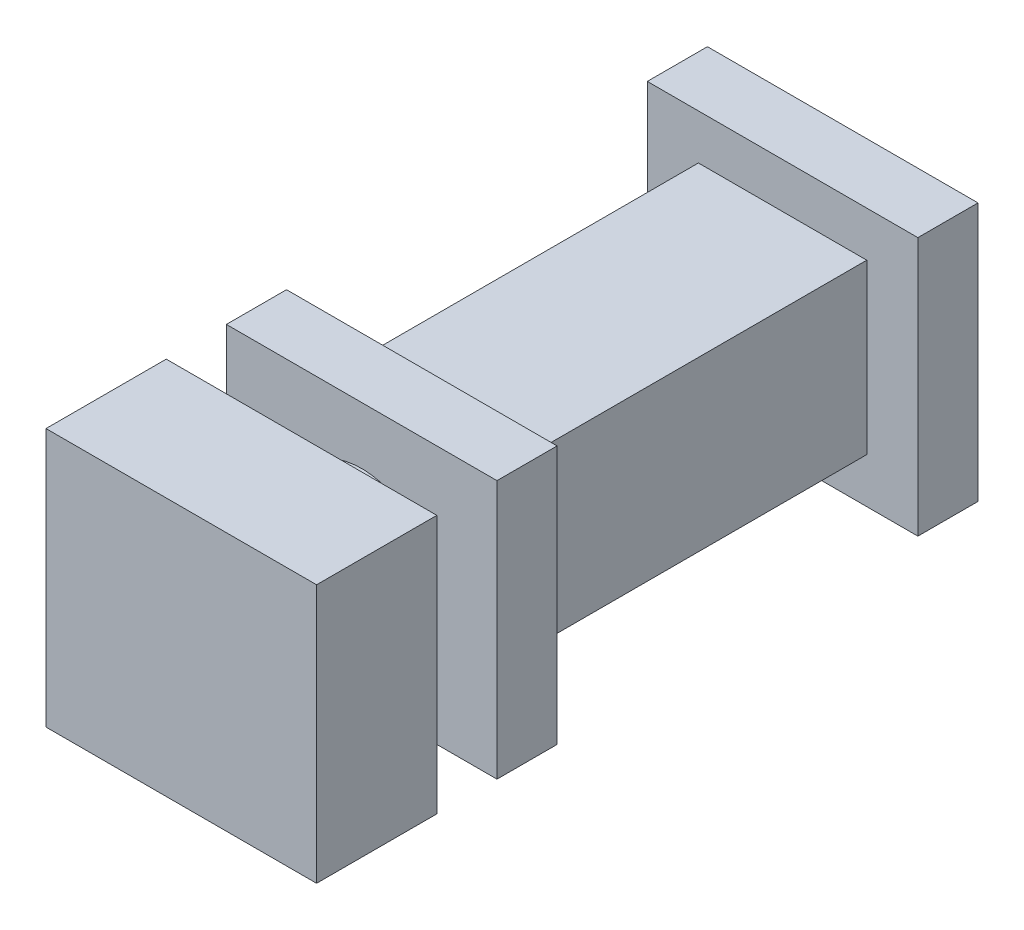
from build123d import *

# Parameters (mm, degrees)
SKETCH_2_W      = 2.25
SKETCH_2_H      = 2.15
EXTRUDE_4_DEPTH = 1
SKETCH_4_R      = 0.6
EXTRUDE_5_DEPTH = 0.5
SKETCH_5_W      = 2.25
SKETCH_5_H      = 2.15
EXTRUDE_6_DEPTH = 0.5
SKETCH_9_W      = 1.4
SKETCH_9_H      = 1.4
EXTRUDE_7_DEPTH = 3
SKETCH_10_W     = 2.25
SKETCH_10_H     = 2.15
EXTRUDE_8_DEPTH = 0.5


with BuildPart() as part:
    # 草图2 → 凸台-拉伸4 (new body)
    with BuildSketch(Plane.XY):
        Rectangle(SKETCH_2_W, SKETCH_2_H)
    extrude(amount=EXTRUDE_4_DEPTH)

    # 草图4 → 凸台-拉伸5 (add)
    with BuildSketch(Plane(origin=(0, 0, 0), x_dir=(-1, 0, 0), z_dir=(0, 0, -1))):
        Circle(SKETCH_4_R)
    extrude(amount=EXTRUDE_5_DEPTH)

    # 草图5 → 凸台-拉伸6 (add)
    with BuildSketch(Plane(origin=(0, 0, -0.5), x_dir=(-1, 0, 0), z_dir=(0, 0, -1))):
        Rectangle(SKETCH_5_W, SKETCH_5_H)
    extrude(amount=EXTRUDE_6_DEPTH)

    # 草图9 → 凸台-拉伸7 (add)
    with BuildSketch(Plane(origin=(0, 0, -1), x_dir=(-1, 0, 0), z_dir=(0, 0, -1))):
        Rectangle(SKETCH_9_W, SKETCH_9_H)
    extrude(amount=EXTRUDE_7_DEPTH)

    # 草图10 → 凸台-拉伸8 (add)
    with BuildSketch(Plane(origin=(0, 0, -4), x_dir=(-1, 0, 0), z_dir=(0, 0, -1))):
        Rectangle(SKETCH_10_W, SKETCH_10_H)
    extrude(amount=EXTRUDE_8_DEPTH)


solid = part.part
